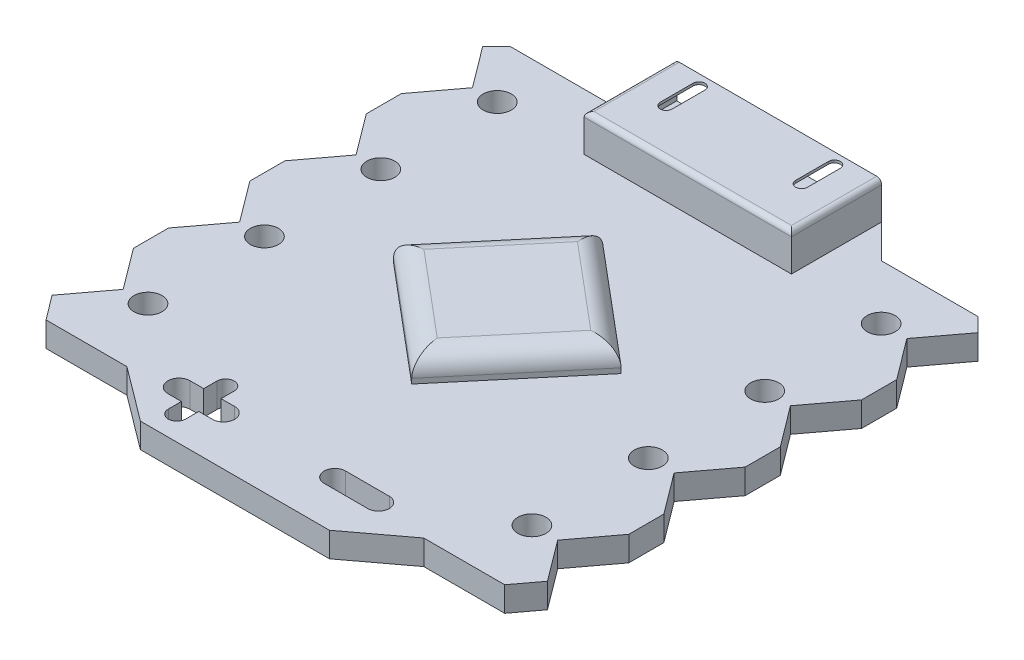
from build123d import *

# Parameters (mm, degrees)
SKETCH1_W            = 20
SKETCH1_H            = 22
BOSS_EXTRUDE1_DEPTH  = 1
CUT_EXTRUDE1_DEPTH   = 2
CUT_EXTRUDE2_DEPTH   = 2
LPATTERN1_COUNT      = 4
LPATTERN1_PITCH      = 4.7
CUT_EXTRUDE3_DEPTH   = 2
SKETCH4_W            = 8.370709726
SKETCH4_H            = 3.642153613
BOSS_EXTRUDE2_DEPTH  = 1.5
SKETCH5_W            = 8.170709726
SKETCH5_H            = 1.3
CUT_EXTRUDE4_DEPTH   = 3.3
CUT_EXTRUDE5_DEPTH   = 1
FILLET1_R            = 0.2
SKETCH7_R            = 0.567557538
CUT_EXTRUDE6_DEPTH   = 1
LPATTERN2_COUNT      = 4
LPATTERN2_PITCH      = 4.7
LPATTERN2_COUNT_DIR2 = 2
LPATTERN2_PITCH_DIR2 = 15.5
BOSS_EXTRUDE3_DEPTH  = 1
FILLET2_R            = 0.8
CUT_EXTRUDE14_DEPTH  = 11


with BuildPart() as part:
    # Sketch1 → Boss-Extrude1 (new body)
    with BuildSketch(Plane(origin=(0, 0, 0), x_dir=(1, 0, 0), z_dir=(0, 1, 0))):
        Rectangle(SKETCH1_W, SKETCH1_H)
    extrude(amount=BOSS_EXTRUDE1_DEPTH)

    # Sketch2 → Cut-Extrude1 (cut)
    with BuildSketch(Plane(origin=(0, 1, 0), x_dir=(1, 0, 0), z_dir=(0, 1, 0))):
        Polygon((5.992999925, -9.366600626), (3.81466663, -11), (10, -11), (10, -8.38038881), (9.260499866, -9.366600626), align=None)
        Polygon((-10, -11), (-3.81466663, -11), (-5.992999925, -9.366600626), (-9.260499866, -9.366600626), (-10, -8.38038881), align=None)
    extrude(amount=-CUT_EXTRUDE1_DEPTH, mode=Mode.SUBTRACT)

    # Sketch2<3> → Cut-Extrude2 (cut)
    with BuildSketch(Plane(origin=(0, 1, 0), x_dir=(1, 0, 0), z_dir=(0, 1, 0))):
        Polygon((8.769646289, -6.739565081), (10, -8.38038881), (10, -5.098741352), align=None)
        Polygon((-10, -5.098741352), (-10, -8.38038881), (-8.769646289, -6.739565081), align=None)
    cut_extrude2 = extrude(amount=-CUT_EXTRUDE2_DEPTH, mode=Mode.SUBTRACT)

    # LPattern1: Cut-Extrude2 ×4
    with Locations(*[(0, 0, -i * LPATTERN1_PITCH) for i in range(1, LPATTERN1_COUNT)]):
        add(cut_extrude2, mode=Mode.SUBTRACT)

    # Sketch3 → Cut-Extrude3 (cut)
    with BuildSketch(Plane(origin=(0, 1, 0), x_dir=(1, 0, 0), z_dir=(0, 1, 0))):
        Polygon((-5.546503539, 9.56506288), (-4.111566419, 11), (-10, 11), (-10, 9.001258648), (-9.436195769, 9.56506288), align=None)
        Polygon((9.436195769, 9.56506288), (10, 9.001258648), (10, 11), (4.111566419, 11), (5.546503539, 9.56506288), align=None)
    extrude(amount=-CUT_EXTRUDE3_DEPTH, mode=Mode.SUBTRACT)

    # Sketch4 → Boss-Extrude2 (add)
    with BuildSketch(Plane(origin=(0, 1, 0), x_dir=(1, 0, 0), z_dir=(0, 1, 0))):
        with Locations((0, 9.105134748)):
            Rectangle(SKETCH4_W, SKETCH4_H)
    extrude(amount=BOSS_EXTRUDE2_DEPTH)

    # Sketch5 → Cut-Extrude4 (cut)
    with BuildSketch(Plane(origin=(0, 0, -10.926211555), x_dir=(-1, 0, 0), z_dir=(0, 0, -1))):
        with Locations((0, 1.75)):
            Rectangle(SKETCH5_W, SKETCH5_H)
    extrude(amount=-CUT_EXTRUDE4_DEPTH, mode=Mode.SUBTRACT)

    # Sketch6 → Cut-Extrude5 (cut)
    with BuildSketch(Plane(origin=(0, 2.5, 0), x_dir=(1, 0, 0), z_dir=(0, 1, 0))):
        with BuildLine():
            Line((-2.493852215, 10.469900747), (-2.493852215, 9.144845176))
            ThreePointArc((-2.493852215, 9.144845176), (-2.733489924, 8.905207467), (-2.973127634, 9.144845176))
            Line((-2.973127634, 9.144845176), (-2.973127634, 10.469900747))
            ThreePointArc((-2.973127634, 10.469900747), (-2.733489924, 10.709538456), (-2.493852215, 10.469900747))
        make_face()
        with BuildLine():
            Line((2.493852215, 10.469900747), (2.493852215, 9.144845176))
            ThreePointArc((2.493852215, 9.144845176), (2.733489924, 8.905207467), (2.973127634, 9.144845176))
            Line((2.973127634, 9.144845176), (2.973127634, 10.469900747))
            ThreePointArc((2.973127634, 10.469900747), (2.733489924, 10.709538456), (2.493852215, 10.469900747))
        make_face()
    extrude(amount=-CUT_EXTRUDE5_DEPTH, mode=Mode.SUBTRACT)

    # Fillet1
    fillet1_edges = [part.edges().sort_by_distance(p)[0] for p in [
        (4.185354863, 2.5, -9.105134749),
        (0, 2.5, -7.284057942),
        (-4.185354863, 2.5, -9.105134749),
    ]]
    fillet(fillet1_edges, radius=FILLET1_R)

    # Sketch7 → Cut-Extrude6 (cut)
    with BuildSketch(Plane(origin=(0, 1, 0), x_dir=(1, 0, 0), z_dir=(0, 1, 0))):
        with Locations((-7.769646289, -6.739565081)):
            Circle(SKETCH7_R)
    cut_extrude6 = extrude(amount=-CUT_EXTRUDE6_DEPTH, mode=Mode.SUBTRACT)

    # LPattern2: Cut-Extrude6 4 × 2
    with Locations(*[(j * LPATTERN2_PITCH_DIR2, 0, -i * LPATTERN2_PITCH) for i in range(LPATTERN2_COUNT) for j in range(LPATTERN2_COUNT_DIR2) if (i, j) != (0, 0)]):
        add(cut_extrude6, mode=Mode.SUBTRACT)

    # Sketch8 → Boss-Extrude3 (add)
    with BuildSketch(Plane(origin=(0, 1, 0), x_dir=(1, 0, 0), z_dir=(0, 1, 0))):
        Polygon((-4.226815495, -0.36610213), (-0.36610213, 4.226815495), (4.226815495, 0.36610213), (0.36610213, -4.226815495), align=None)
    extrude(amount=BOSS_EXTRUDE3_DEPTH)

    # Fillet2
    fillet2_edges = [part.edges().sort_by_distance(p)[0] for p in [
        (-2.296458812, 2, -1.930356683),
        (1.930356683, 2, -2.296458812),
        (2.296458812, 2, 1.930356683),
        (-1.930356683, 2, 2.296458812),
    ]]
    fillet(fillet2_edges, radius=FILLET2_R)

    # Sketch10 → Cut-Extrude14 (cut)
    with BuildSketch(Plane(origin=(0, 2, 0), x_dir=(1, 0, 0), z_dir=(0, 1, 0))):
        with BuildLine():
            Line((-3.673604306, -8.585549508), (-4.222941213, -8.585549508))
            ThreePointArc((-4.222941213, -8.585549508), (-4.672398683, -9.035006978), (-4.222941213, -9.484464447))
            Line((-4.222941213, -9.484464447), (-3.673604306, -9.484464447))
            Line((-3.673604306, -9.484464447), (-3.673604306, -10.017154782))
            ThreePointArc((-3.673604306, -10.017154782), (-3.324026274, -10.366732814), (-2.974448243, -10.017154782))
            Line((-2.974448243, -10.017154782), (-2.974448243, -9.484464447))
            Line((-2.974448243, -9.484464447), (-2.425111335, -9.484464447))
            ThreePointArc((-2.425111335, -9.484464447), (-1.975653866, -9.035006978), (-2.425111335, -8.585549508))
            Line((-2.425111335, -8.585549508), (-2.974448243, -8.585549508))
            Line((-2.974448243, -8.585549508), (-2.974448243, -8.052859174))
            ThreePointArc((-2.974448243, -8.052859174), (-3.324026274, -7.703281142), (-3.673604306, -8.052859174))
            Line((-3.673604306, -8.052859174), (-3.673604306, -8.585549508))
        make_face()
        with BuildLine():
            Line((3.834000092, -8.602196081), (2.06946336, -8.602196081))
            ThreePointArc((2.06946336, -8.602196081), (1.636652464, -9.035006978), (2.06946336, -9.467817874))
            Line((2.06946336, -9.467817874), (3.834000092, -9.467817874))
            ThreePointArc((3.834000092, -9.467817874), (4.266810989, -9.035006978), (3.834000092, -8.602196081))
        make_face()
    extrude(amount=-CUT_EXTRUDE14_DEPTH, mode=Mode.SUBTRACT)


solid = part.part
